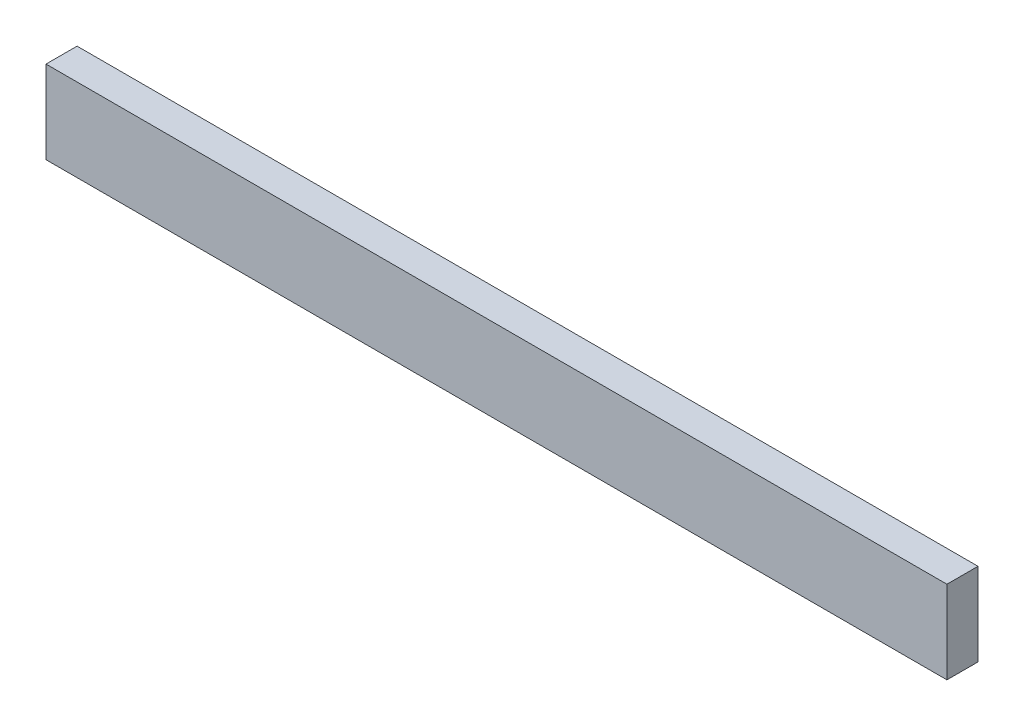
from build123d import *

# Parameters (mm, degrees)
SKETCH1_W           = 552.45
SKETCH1_H           = 50.8
BOSS_EXTRUDE1_DEPTH = 19.05


with BuildPart() as part:
    # Sketch1 → Boss-Extrude1 (new body)
    with BuildSketch(Plane.XY):
        with Locations((276.225, 25.4)):
            Rectangle(SKETCH1_W, SKETCH1_H)
    extrude(amount=BOSS_EXTRUDE1_DEPTH)


solid = part.part
